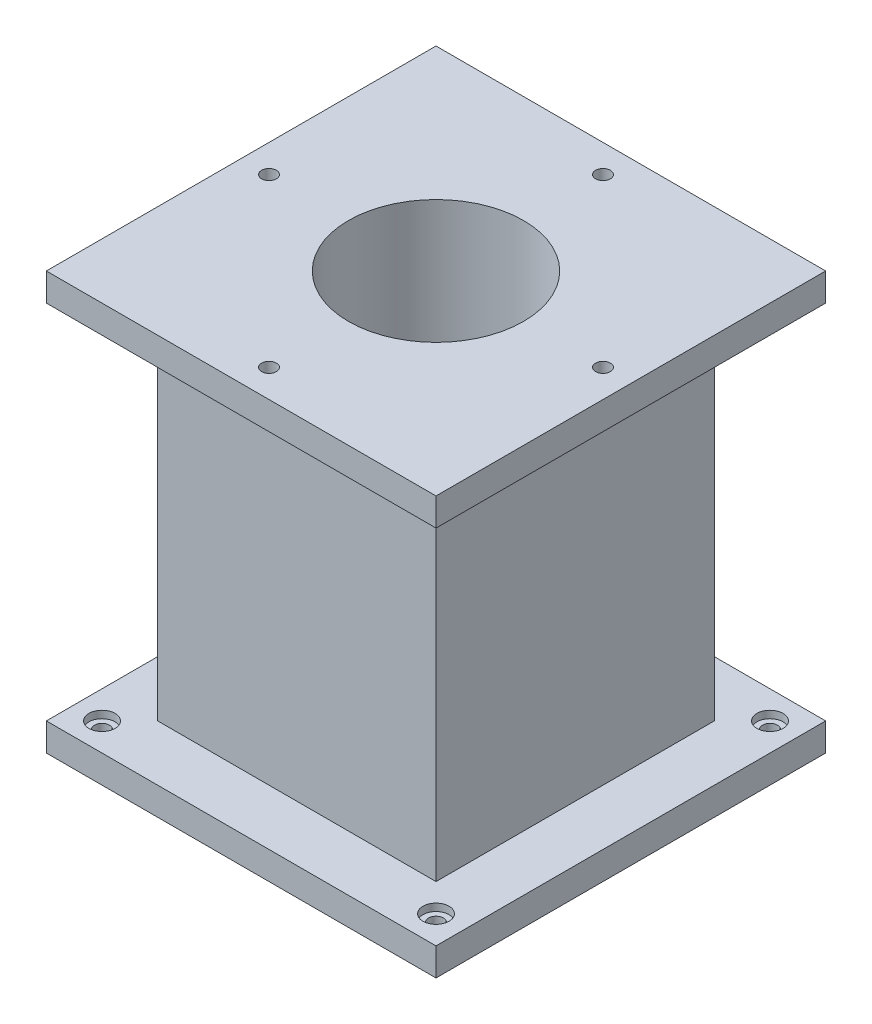
from build123d import *

# Parameters (mm, degrees)
SKETCH1_W           = 177.8
SKETCH1_H           = 177.8
BOSS_EXTRUDE1_DEPTH = 12.7
LPATTERN1_COUNT     = 2
LPATTERN1_PITCH     = 177.8
CIRPATTERN1_COUNT   = 4
CIRPATTERN2_COUNT   = 4
BOSS_EXTRUDE2_REACH = 219.76
SKETCH11_W          = 127
SKETCH11_H          = 127
SKETCH12_R          = 39.925273759
CUT_EXTRUDE1_DEPTH  = 229.246949596


with BuildPart() as part:
    # Sketch1 → Boss-Extrude1 (new body)
    with BuildSketch(Plane(origin=(0, 0, 0), x_dir=(1, 0, 0), z_dir=(0, 1, 0))):
        Rectangle(SKETCH1_W, SKETCH1_H)
    extrude(amount=BOSS_EXTRUDE1_DEPTH)


with BuildPart() as lpattern1_1:
    # LPattern1: pattern copy
    add(part.part.moved(Location(Vector(0, 1, 0) * (1 * LPATTERN1_PITCH))))

    # Sketch10 → CBORE for 1/4 Button Head Cap Screw2 (revolve, cut)
    with BuildSketch(Plane(origin=(76.2, 177.8, 0), x_dir=(0, 0, -1), z_dir=(1, 0, 0))):
        Polygon((0, 0), (0, 12.7), (3.3782, 12.7), (3.3782, 3.3528), (5.95376, 3.3528), (5.95376, 0), align=None)
    cbore_for_1_4_button_head_cap_screw2 = revolve(axis=Axis((76.2, 171.45, 0), (0, 1, 0)), mode=Mode.SUBTRACT)

    # CirPattern2: CBORE for 1/4 Button Head Cap Screw2 ×4 about axis
    cirpattern2_axis = Axis((0, -0.635, 0), (0, 1, 0))
    for i in range(1, CIRPATTERN2_COUNT):
        add(cbore_for_1_4_button_head_cap_screw2.rotate(cirpattern2_axis, i * 360 / CIRPATTERN2_COUNT), mode=Mode.SUBTRACT)

    # Sketch11 → Boss-Extrude2 (add, up to next)
    with BuildSketch(Plane(origin=(0, 12.7, 0), x_dir=(1, 0, 0), z_dir=(0, 1, 0)), mode=Mode.PRIVATE) as boss_extrude2_sk1:
        Rectangle(SKETCH11_W, SKETCH11_H)
    boss_extrude2_tool1 = extrude(boss_extrude2_sk1.sketch, amount=BOSS_EXTRUDE2_REACH, mode=Mode.PRIVATE) - lpattern1_1.part


with BuildPart() as part_1:
    add(part.part)

    # Sketch5 → CBORE for 1/4 Button Head Cap Screw1 (revolve, cut)
    with BuildSketch(Plane(origin=(76.2, 12.7, -76.2), x_dir=(0, 0, 1), z_dir=(1, 0, 0))):
        Polygon((0, 0), (0, 12.7), (3.3782, 12.7), (3.3782, 3.3528), (5.95376, 3.3528), (5.95376, 0), align=None)
    cbore_for_1_4_button_head_cap_screw1 = revolve(axis=Axis((76.2, 19.05, -76.2), (0, -1, 0)), mode=Mode.SUBTRACT)

    # CirPattern1: CBORE for 1/4 Button Head Cap Screw1 ×4 about axis
    cirpattern1_axis = Axis((0, -0.635, 0), (0, 1, 0))
    for i in range(1, CIRPATTERN1_COUNT):
        add(cbore_for_1_4_button_head_cap_screw1.rotate(cirpattern1_axis, i * 360 / CIRPATTERN1_COUNT), mode=Mode.SUBTRACT)


with BuildPart() as lpattern1_1_1:
    add(lpattern1_1.part)

    add(part_1.part)  # Boss-Extrude2 merges part
    add(boss_extrude2_tool1.solids().sort_by_distance((0, 12.7, 0))[0])

    # Sketch12 → Cut-Extrude1 (cut, through all)
    with BuildSketch(Plane(origin=(0, 190.5, 0), x_dir=(1, 0, 0), z_dir=(0, 1, 0))):
        Circle(SKETCH12_R)
    extrude(amount=-CUT_EXTRUDE1_DEPTH, mode=Mode.SUBTRACT)


solid = lpattern1_1_1.part
